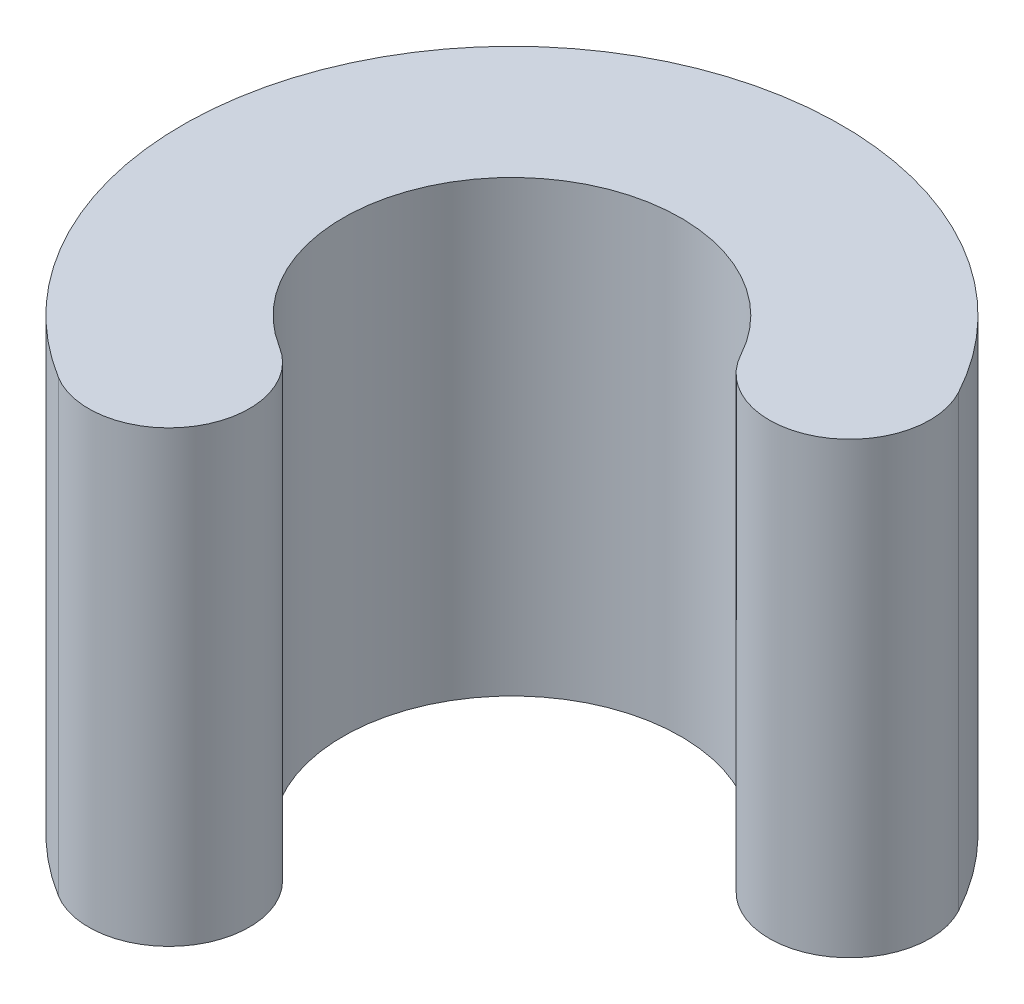
from build123d import *

# Parameters (mm, degrees)
ESTRUSIONE_ESTRUSIONE1_DEPTH = 10.9


with BuildPart() as part:
    # Schizzo1 → Estrusione-Estrusione1 (new body)
    with BuildSketch(Plane(origin=(0, 0, 0), x_dir=(1, 0, 0), z_dir=(0, 1, 0))):
        with BuildLine():
            ThreePointArc((-2.151851846, -3.489918858), (-2.814062516, 2.981786738), (3.608517792, 1.946432465))
            ThreePointArc((3.608517792, 1.946432465), (4.39902179, 4.588421002), (7.041010327, 3.797917005))
            ThreePointArc((7.041010327, 3.797917005), (-5.49085365, 5.818120504), (-4.198735404, -6.809597712))
            ThreePointArc((-4.198735404, -6.809597712), (-4.835133005, -4.126316535), (-2.151851846, -3.489918858))
        make_face()
        with BuildLine():
            ThreePointArc((-1.225293577, -5.149758315), (-1.47261754, -4.199287741), (-2.151851846, -3.489918858))
            ThreePointArc((-2.151851846, -3.489918858), (-4.835133005, -4.126316535), (-4.198735404, -6.809597712))
            ThreePointArc((-4.198735404, -6.809597712), (-2.224823052, -6.852434379), (-1.225293577, -5.149758315))
        make_face()
        with BuildLine():
            ThreePointArc((7.041010327, 3.797917005), (4.39902179, 4.588421002), (3.608517792, 1.946432465))
            ThreePointArc((3.608517792, 1.946432465), (5.802163148, 0.981516091), (7.27476406, 2.872174735))
            ThreePointArc((7.27476406, 2.872174735), (7.215422704, 3.349573823), (7.041010327, 3.797917005))
        make_face()
    extrude(amount=ESTRUSIONE_ESTRUSIONE1_DEPTH)


solid = part.part
